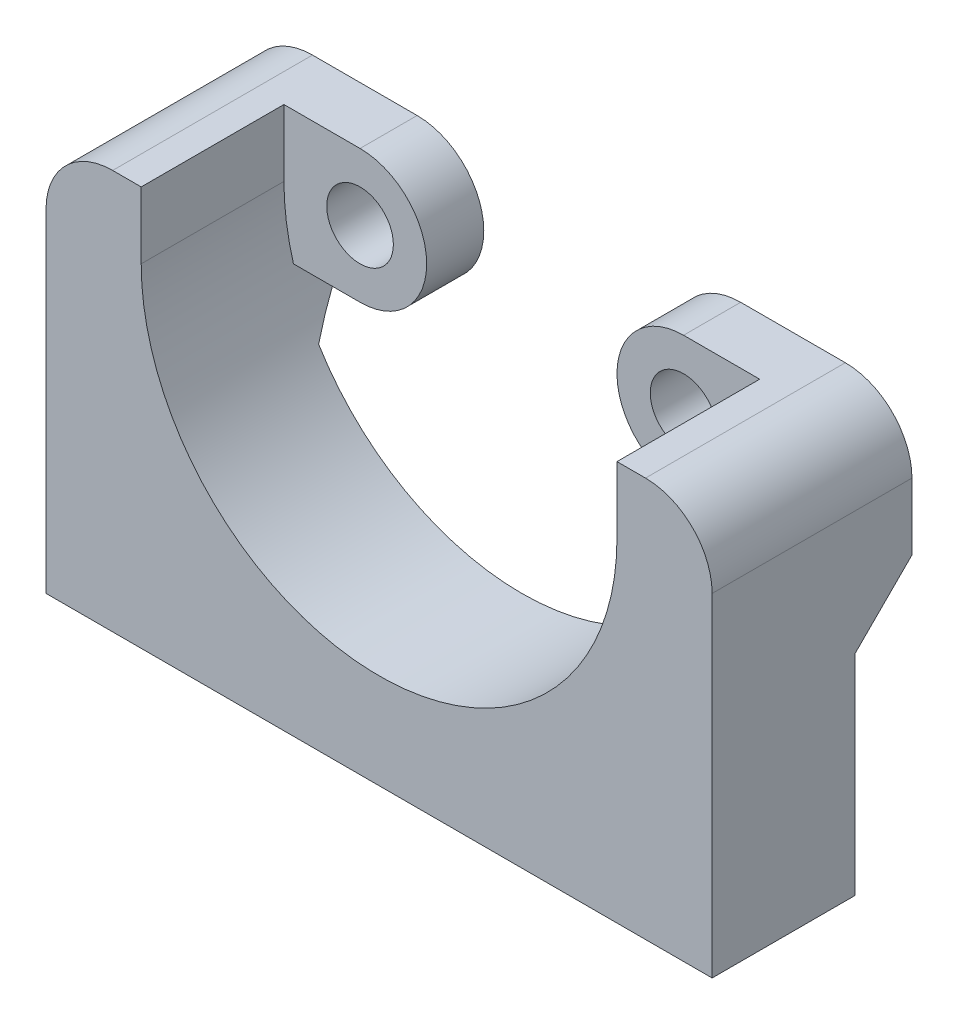
from build123d import *

# Parameters (mm, degrees)
BOSS_EXTRUDE1_DEPTH = 7.5
SKETCH2_R           = 1.75
BOSS_EXTRUDE2_DEPTH = 3
SKETCH3_W           = 5
SKETCH3_H           = 7.5
BOSS_EXTRUDE3_DEPTH = 3.5
CUT_EXTRUDE1_DEPTH  = 29.346075566
BOSS_EXTRUDE4_DEPTH = 3
RIB1_REACH          = 43.5
SKETCH7_WALL_W      = 89.242640688
SKETCH7_WALL_H      = 5.25255129
BOSS_EXTRUDE5_DEPTH = 2
CUT_EXTRUDE2_DEPTH  = 29.346075566


with BuildPart() as part:
    # Sketch1 → Boss-Extrude1 (new body)
    with BuildSketch(Plane.XY):
        with BuildLine():
            Line((-17.5, 0), (17.5, 0))
            Line((17.5, 0), (17.5, 17.5))
            Line((17.5, 17.5), (12.5, 17.5))
            ThreePointArc((12.5, 17.5), (0, 5), (-12.5, 17.5))
            Line((-12.5, 17.5), (-17.5, 17.5))
            Line((-17.5, 17.5), (-17.5, 0))
        make_face()
    extrude(amount=BOSS_EXTRUDE1_DEPTH)

    # Sketch2 → Boss-Extrude2 (add)
    # profile 1 of 2: a face of its own
    with BuildSketch(Plane(origin=(0, 0, 0), x_dir=(-1, 0, 0), z_dir=(0, 0, -1))):
        with BuildLine():
            Line((-8.5, 14), (-14, 14))
            ThreePointArc((-14, 14), (-17.5, 17.5), (-14, 21))
            Line((-14, 21), (-8.5, 21))
            ThreePointArc((-8.5, 21), (-5, 17.5), (-8.5, 14))
        make_face()
        with Locations((-8.5, 17.5)):
            Circle(SKETCH2_R, mode=Mode.SUBTRACT)
    # profile 2 of 2: a face of its own
    with BuildSketch(Plane(origin=(0, 0, 0), x_dir=(-1, 0, 0), z_dir=(0, 0, -1))):
        with BuildLine():
            Line((8.5, 14), (14, 14))
            ThreePointArc((14, 14), (17.5, 17.5), (14, 21))
            Line((14, 21), (8.5, 21))
            ThreePointArc((8.5, 21), (5, 17.5), (8.5, 14))
        make_face()
        with Locations(Location((8.5, 17.5, 0), (0, 0, 180))):
            Circle(SKETCH2_R, mode=Mode.SUBTRACT)
    extrude(amount=BOSS_EXTRUDE2_DEPTH)

    # Sketch3 → Boss-Extrude3 (add)
    with BuildSketch(Plane(origin=(0, 17.5, 0), x_dir=(1, 0, 0), z_dir=(0, 1, 0))):
        with Locations((15, -3.75)):
            Rectangle(SKETCH3_W, SKETCH3_H)
        with Locations((-15, -3.75)):
            Rectangle(SKETCH3_W, SKETCH3_H)
    extrude(amount=BOSS_EXTRUDE3_DEPTH)

    # Sketch4 → Cut-Extrude1 (cut, through all)
    with BuildSketch(Plane(origin=(0, 0, 0), x_dir=(-1, 0, 0), z_dir=(0, 0, -1))):
        with BuildLine():
            Line((17.5, 21), (17.5, 17.5))
            ThreePointArc((17.5, 17.5), (16.474873734, 19.974873734), (14, 21))
            Line((14, 21), (17.5, 21))
        make_face()
    cut_extrude1 = extrude(amount=-CUT_EXTRUDE1_DEPTH, mode=Mode.SUBTRACT)

    # Sketch5 → Boss-Extrude4 (add)
    with BuildSketch(Plane(origin=(0, 0, 0), x_dir=(-1, 0, 0), z_dir=(0, 0, -1))):
        with BuildLine():
            Line((14, 14), (17.5, 14))
            Line((17.5, 14), (17.5, 17.5))
            ThreePointArc((17.5, 17.5), (16.474873734, 15.025126266), (14, 14))
        make_face()
    boss_extrude4 = extrude(amount=BOSS_EXTRUDE4_DEPTH)

    # Mirror1: Cut-Extrude1, Boss-Extrude4 across plane
    add(cut_extrude1.mirror(Plane(origin=(0, 0, 0), x_dir=(0, 0, 1), z_dir=(1, 0, 0))), mode=Mode.SUBTRACT)
    add(boss_extrude4.mirror(Plane(origin=(0, 0, 0), x_dir=(0, 0, 1), z_dir=(1, 0, 0))))

    # Sketch7 wall → Rib1 (add, up to next)
    with BuildSketch(Plane(origin=(17.5, 12.5, -1.5), x_dir=(0, -0.707106781187, 0.707106781187), z_dir=(0, -0.707106781187, -0.707106781187)), mode=Mode.PRIVATE) as rib1_sk1:
        with Locations((0, 2.626275645)):
            Rectangle(SKETCH7_WALL_W, SKETCH7_WALL_H)
    rib1_tool1 = extrude(rib1_sk1.sketch, amount=-RIB1_REACH, mode=Mode.PRIVATE) - part.part
    rib1 = rib1_tool1.solids().sort_by_distance((17.5, 12.5, -1.5))[0]
    add(rib1)

    # Mirror2: Rib1 across plane
    add(rib1.mirror(Plane(origin=(0, 0, 0), x_dir=(0, 0, 1), z_dir=(1, 0, 0))))

    # Sketch8 → Boss-Extrude5 (add)
    with BuildSketch(Plane(origin=(-12.24744871, 0, 0), x_dir=(0, 0, -1), z_dir=(1, 0, 0))):
        Polygon((3, 14), (0, 11), (0, 14), align=None)
    boss_extrude5 = extrude(amount=BOSS_EXTRUDE5_DEPTH)

    # Sketch9 → Cut-Extrude2 (cut, through all)
    with BuildSketch(Plane.XY):
        with BuildLine():
            Line((-10.24744871, 14), (-12, 14))
            ThreePointArc((-12, 14), (-11.437327901, 12.456436727), (-10.677078252, 11))
            Line((-10.677078252, 11), (-10.24744871, 11))
            Line((-10.24744871, 11), (-10.24744871, 14))
        make_face()
    cut_extrude2 = extrude(amount=-CUT_EXTRUDE2_DEPTH, mode=Mode.SUBTRACT)

    # Mirror3: Boss-Extrude5, Cut-Extrude2 across plane
    add(boss_extrude5.mirror(Plane(origin=(0, 0, 0), x_dir=(0, 0, 1), z_dir=(1, 0, 0))))
    add(cut_extrude2.mirror(Plane(origin=(0, 0, 0), x_dir=(0, 0, 1), z_dir=(1, 0, 0))), mode=Mode.SUBTRACT)


solid = part.part
